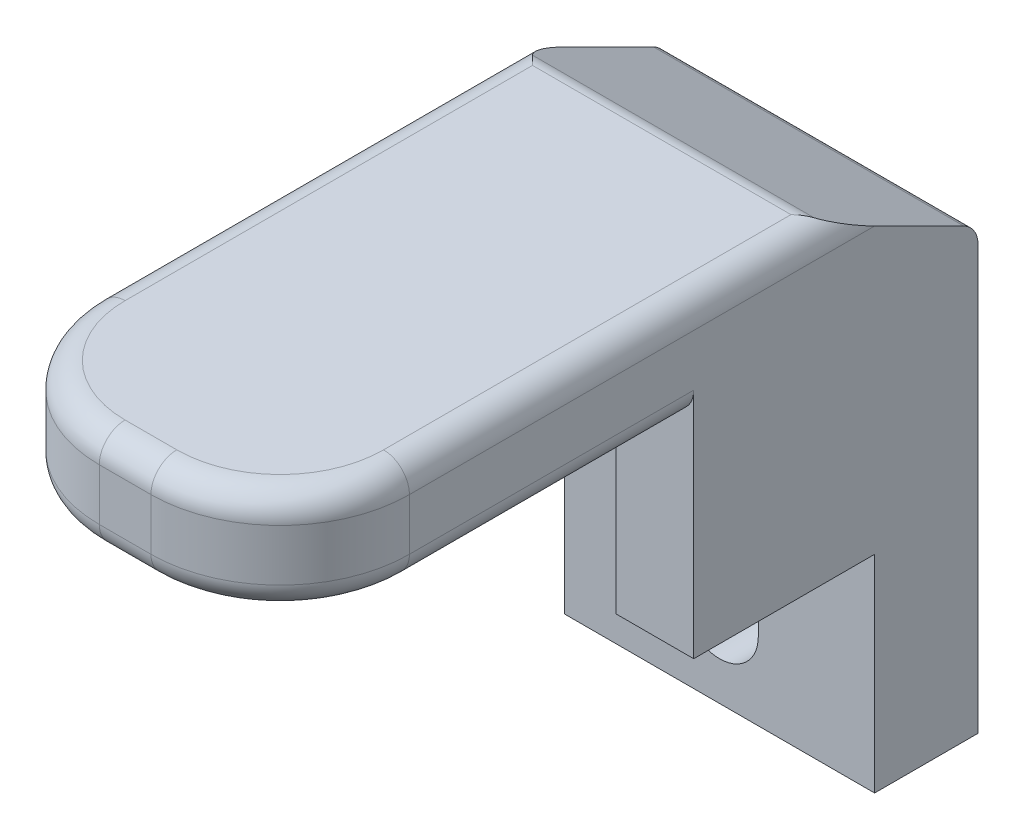
from build123d import *

# Parameters (mm, degrees)
SKETCH_2_W          = 12
SKETCH_2_H          = 20
EXTRUDE_1_DEPTH     = 4
EXTRUDE_START       = -4
SKETCH_3_W          = 12
SKETCH_3_H          = 4
EXTRUDE_2_DEPTH     = 27
SKETCH_4_W          = 3
SKETCH_4_H          = 8
EXTRUDE_3_DEPTH     = 7
FILLET_5_R          = 5
CUT_EXTRUDE_2_DEPTH = 36.678984208
FILLET_6_R          = 1


with BuildPart() as part:
    # 草图2 → 凸台-拉伸1 (new body)
    with BuildSketch(Plane.XY):
        with Locations((7.449786368, 9.999747852)):
            Rectangle(SKETCH_2_W, SKETCH_2_H)
        with BuildLine():
            Line((5.949786368, 6.499747852), (5.949786368, 2.999747852))
            ThreePointArc((5.949786368, 2.999747852), (7.449786368, 1.499747852), (8.949786368, 2.999747852))
            Line((8.949786368, 2.999747852), (8.949786368, 6.499747852))
            Line((8.949786368, 6.499747852), (5.949786368, 6.499747852))
        make_face(mode=Mode.SUBTRACT)
        with BuildLine():
            Line((5.949786368, 11.999747852), (8.949786368, 11.999747852))
            Line((8.949786368, 11.999747852), (8.949786368, 16.999747852))
            ThreePointArc((8.949786368, 16.999747852), (7.449786368, 18.499747852), (5.949786368, 16.999747852))
            Line((5.949786368, 16.999747852), (5.949786368, 11.999747852))
        make_face(mode=Mode.SUBTRACT)
    extrude(amount=EXTRUDE_1_DEPTH)

    # 草图3 → 凸台-拉伸2 (add)
    with BuildSketch(Plane.XY.offset(4).offset(EXTRUDE_START)):
        with Locations((7.449786368, 17.999747852)):
            Rectangle(SKETCH_3_W, SKETCH_3_H)
    extrude(amount=EXTRUDE_2_DEPTH)

    # 草图4 → 凸台-拉伸3 (add)
    with BuildSketch(Plane.XY.offset(4)):
        with Locations((2.949786368, 11.999747852)):
            Rectangle(SKETCH_4_W, SKETCH_4_H)
        with Locations((11.949786368, 11.999747852)):
            Rectangle(SKETCH_4_W, SKETCH_4_H)
    extrude(amount=EXTRUDE_3_DEPTH)

    # 圆角5
    fillet_5_edges = [part.edges().sort_by_distance(p)[0] for p in [
        (1.449786368, 17.999747852, 27),
        (13.449786368, 17.999747852, 27),
    ]]
    fillet(fillet_5_edges, radius=FILLET_5_R)

    # 草图8 → 切除-拉伸2 (cut, through all)
    with BuildSketch(Plane.ZY.offset(-1.449786368)):
        Polygon((0, 16.999747852), (6, 19.999747852), (0, 19.999747852), align=None)
    extrude(amount=-CUT_EXTRUDE_2_DEPTH, mode=Mode.SUBTRACT)

    # 圆角6
    fillet_6_edges = [part.edges().sort_by_distance(p)[0] for p in [
        (11.985320274, 15.999747852, 25.535533906),
        (7.449786368, 16.999747852, 0),
        (7.449786368, 19.999747852, 6),
        (1.449786368, 15.999747852, 16.5),
        (13.449786368, 15.999747852, 16.5),
        (7.449786368, 15.999747852, 27),
        (7.449786368, 19.999747852, 27),
        (1.449786368, 19.999747852, 14),
        (13.449786368, 19.999747852, 14),
        (2.914252462, 19.999747852, 25.535533906),
        (11.985320274, 19.999747852, 25.535533906),
        (2.914252462, 15.999747852, 25.535533906),
    ]]
    fillet(fillet_6_edges, radius=FILLET_6_R)


solid = part.part
